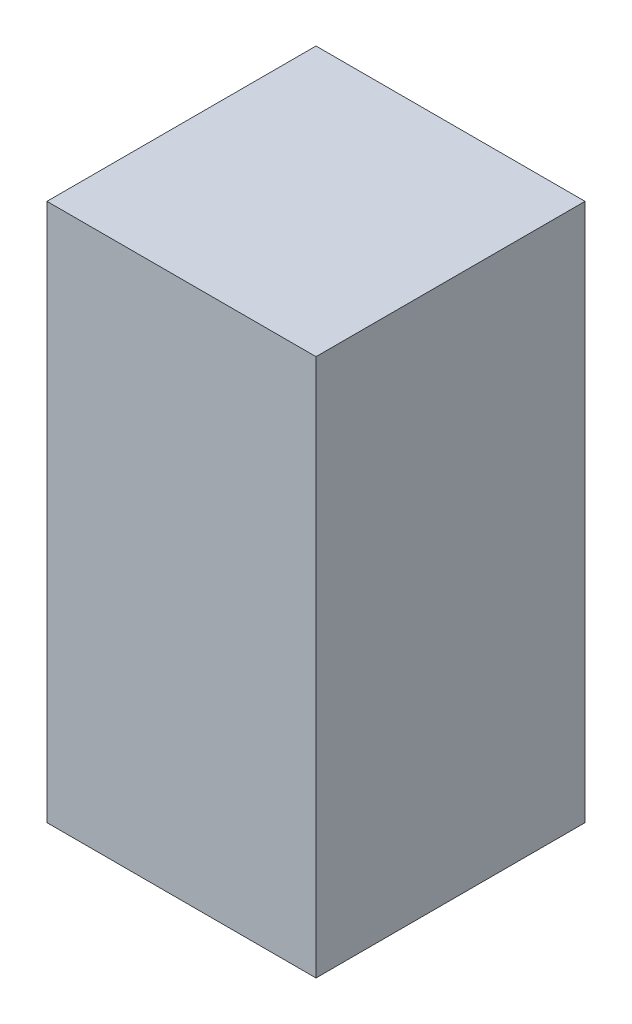
from build123d import *

# Parameters (mm, degrees)
SKETCH1_W           = 100
SKETCH1_H           = 100
BOSS_EXTRUDE1_DEPTH = 200


with BuildPart() as part:
    # Sketch1 → Boss-Extrude1 (new body)
    with BuildSketch(Plane(origin=(0, 0, 0), x_dir=(1, 0, 0), z_dir=(0, 1, 0))):
        Rectangle(SKETCH1_W, SKETCH1_H)
    extrude(amount=BOSS_EXTRUDE1_DEPTH)


solid = part.part
